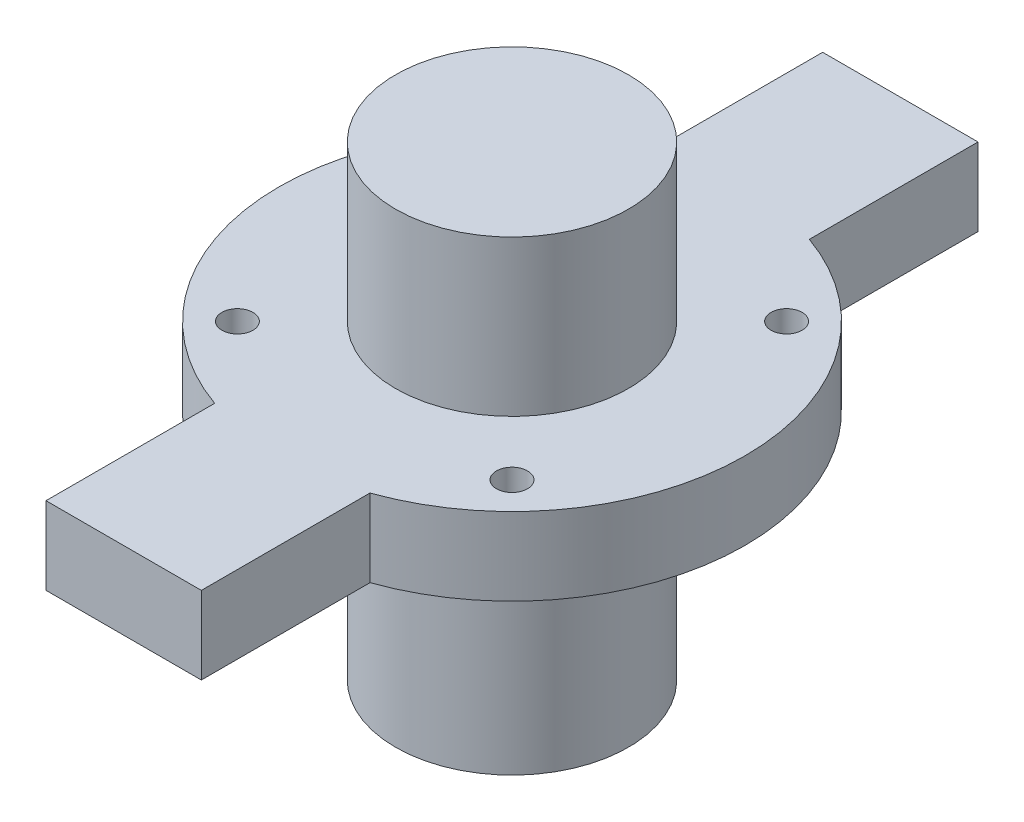
from build123d import *
from build123d.topology import SkipClean

# Parameters (mm, degrees)
SKETCH1_R           = 30
SKETCH1_R_2         = 15
SKETCH1_R_3         = 2
BOSS_EXTRUDE1_DEPTH = 10
BOSS_EXTRUDE2_START = -10
BOSS_EXTRUDE2_DEPTH = 10
SKETCH5_R           = 15
BOSS_EXTRUDE3_DEPTH = 30


with BuildPart() as part:
    # Sketch1 → Boss-Extrude1 (new body)
    with BuildSketch(Plane(origin=(0, 0, 0), x_dir=(1, 0, 0), z_dir=(0, 1, 0))):
        with Locations(Location((0, 0, 0), (0, 0, 270))):
            Circle(SKETCH1_R)
        with Locations(Location((0, 0, 0), (0, 0, 270))):
            Circle(SKETCH1_R_2, mode=Mode.SUBTRACT)
        with Locations(Location((-17.67766953, 17.67766953, 0), (0, 0, 270))):
            Circle(SKETCH1_R_3, mode=Mode.SUBTRACT)
        with Locations(Location((17.67766953, 17.67766953, 0), (0, 0, 270))):
            Circle(SKETCH1_R_3, mode=Mode.SUBTRACT)
        with Locations(Location((17.67766953, -17.67766953, 0), (0, 0, 270))):
            Circle(SKETCH1_R_3, mode=Mode.SUBTRACT)
        with Locations(Location((-17.67766953, -17.67766953, 0), (0, 0, 270))):
            Circle(SKETCH1_R_3, mode=Mode.SUBTRACT)
    extrude(amount=BOSS_EXTRUDE1_DEPTH)

    # Sketch2 → Boss-Extrude2 (add)
    with SkipClean():  # the faces are left unmerged after this step: merging them gives an invalid solid
        with BuildSketch(Plane(origin=(0, 10, 0), x_dir=(1, 0, 0), z_dir=(0, 1, 0)).offset(BOSS_EXTRUDE2_START)):
            with BuildLine():
                ThreePointArc((-10, 11.180339887), (0, 15), (10, 11.180339887))
                Line((10, 11.180339887), (10, 28.284271247))
                ThreePointArc((10, 28.284271247), (0, 30), (-10, 28.284271247))
                Line((-10, 28.284271247), (-10, 11.180339887))
            make_face()
            with BuildLine():
                ThreePointArc((-10, 28.284271247), (0, 30), (10, 28.284271247))
                Line((10, 28.284271247), (10, 50))
                Line((10, 50), (-10, 50))
                Line((-10, 50), (-10, 28.284271247))
            make_face()
            with BuildLine():
                ThreePointArc((10, -11.180339887), (0, -15), (-10, -11.180339887))
                Line((-10, -11.180339887), (-10, -28.284271247))
                ThreePointArc((-10, -28.284271247), (0, -30), (10, -28.284271247))
                Line((10, -28.284271247), (10, -11.180339887))
            make_face()
            with BuildLine():
                Line((10, -50), (10, -28.284271247))
                ThreePointArc((10, -28.284271247), (0, -30), (-10, -28.284271247))
                Line((-10, -28.284271247), (-10, -50))
                Line((-10, -50), (10, -50))
            make_face()
        extrude(amount=BOSS_EXTRUDE2_DEPTH)

    # Sketch5 → Boss-Extrude3 (add, symmetric)
    with BuildSketch(Plane(origin=(0, 0, 0), x_dir=(1, 0, 0), z_dir=(0, 1, 0))):
        with Locations(Location((0, 0, 0), (0, 0, 270))):
            Circle(SKETCH5_R)
    extrude(amount=BOSS_EXTRUDE3_DEPTH, both=True)


solid = part.part
